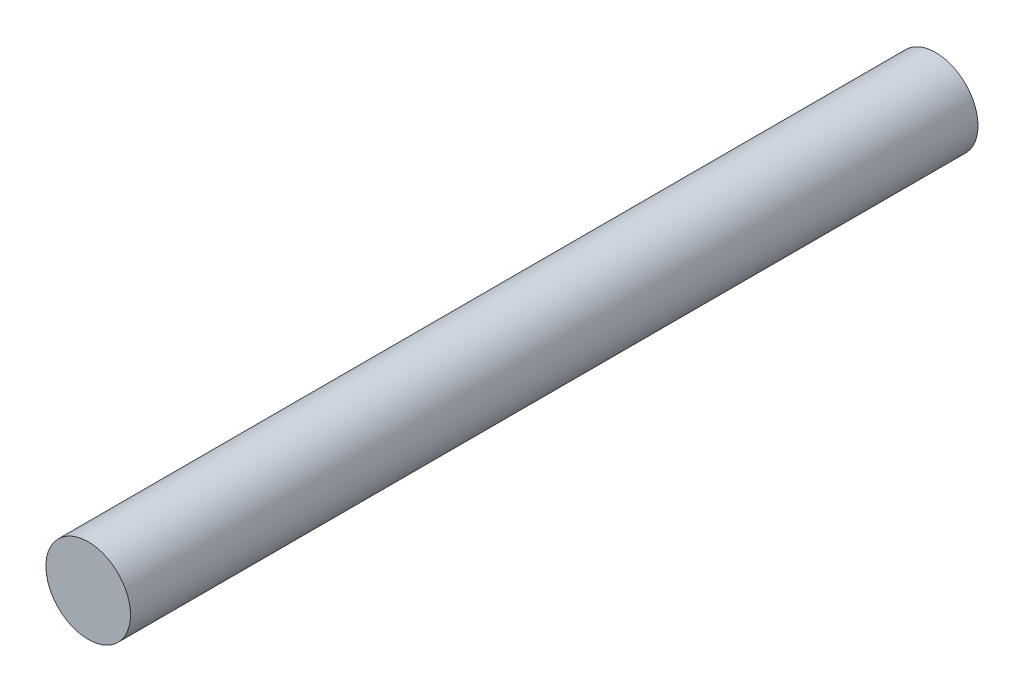
from build123d import *

# Parameters (mm, degrees)
SKETCH1_R           = 3.2385
BOSS_EXTRUDE1_DEPTH = 64.897


with BuildPart() as part:
    # Sketch1 → Boss-Extrude1 (new body)
    with BuildSketch(Plane.XY):
        Circle(SKETCH1_R)
    extrude(amount=BOSS_EXTRUDE1_DEPTH)


solid = part.part
